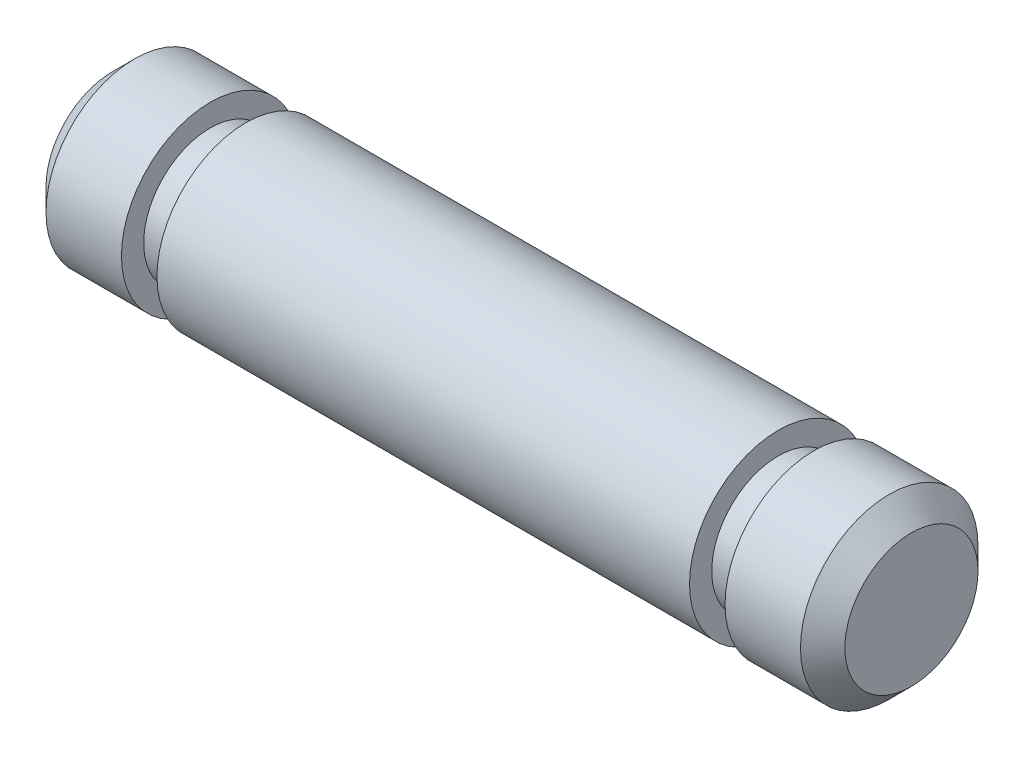
from build123d import *

# Parameters (mm, degrees)
SKETCH1_R           = 2
BOSS_EXTRUDE1_DEPTH = 6
SKETCH2_R           = 1.5
BOSS_EXTRUDE2_DEPTH = 0.8
BOSS_EXTRUDE3_START = 2.2
SKETCH3_R           = 2
BOSS_EXTRUDE3_DEPTH = 2.2
CHAMFER1_SIZE       = 0.5


with BuildPart() as part:
    # Sketch1 → Boss-Extrude1 (new, symmetric)
    with BuildSketch(Plane(origin=(0, 0, 0), x_dir=(0, 0, -1), z_dir=(1, 0, 0))):
        Circle(SKETCH1_R)
    extrude(amount=BOSS_EXTRUDE1_DEPTH, both=True)

    # Sketch2 → Boss-Extrude2 (add)
    with BuildSketch(Plane(origin=(6, 0, 0), x_dir=(0, 0, -1), z_dir=(1, 0, 0))):
        Circle(SKETCH2_R)
    boss_extrude2 = extrude(amount=BOSS_EXTRUDE2_DEPTH)

    # Sketch3 → Boss-Extrude3 (add)
    with BuildSketch(Plane(origin=(6.8, 0, 0), x_dir=(0, 0, -1), z_dir=(1, 0, 0)).offset(BOSS_EXTRUDE3_START)):
        Circle(SKETCH3_R)
    boss_extrude3 = extrude(amount=-BOSS_EXTRUDE3_DEPTH)

    # Mirror1: Boss-Extrude2, Boss-Extrude3 across plane
    add(boss_extrude2.mirror(Plane(origin=(0, 0, 0), x_dir=(0, 0, 1), z_dir=(1, 0, 0))))
    add(boss_extrude3.mirror(Plane(origin=(0, 0, 0), x_dir=(0, 0, 1), z_dir=(1, 0, 0))))

    # Chamfer1
    chamfer1_edges = [part.edges().sort_by_distance(p)[0] for p in [
        (9, 0, 2),
        (-9, 0, 2),
    ]]
    chamfer(chamfer1_edges, length=CHAMFER1_SIZE)


solid = part.part
